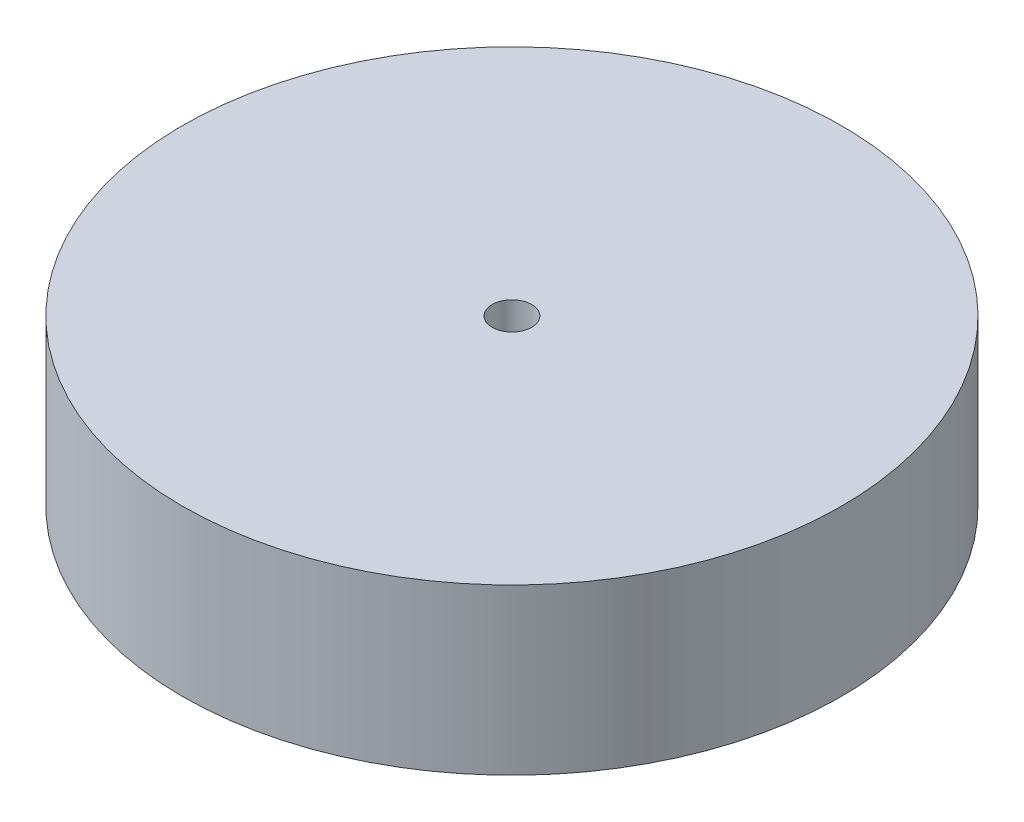
from build123d import *

# Parameters (mm, degrees)
SKETCH1_R           = 50
SKETCH1_R_2         = 3
BOSS_EXTRUDE1_DEPTH = 25


with BuildPart() as part:
    # Sketch1 → Boss-Extrude1 (new body)
    with BuildSketch(Plane(origin=(0, 0, 0), x_dir=(1, 0, 0), z_dir=(0, 1, 0))):
        with Locations(Location((0, 0, 0), (0, 0, 270))):
            Circle(SKETCH1_R)
        with Locations(Location((0, 0, 0), (0, 0, 270))):
            Circle(SKETCH1_R_2, mode=Mode.SUBTRACT)
    extrude(amount=BOSS_EXTRUDE1_DEPTH)


solid = part.part
